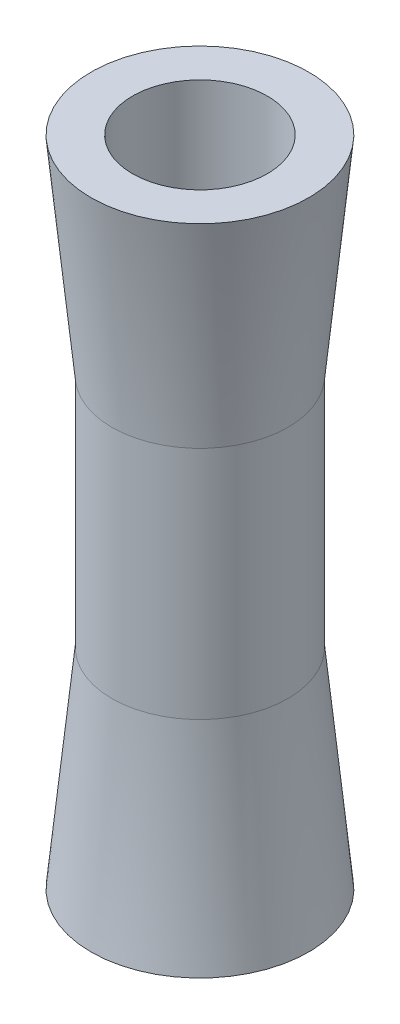
from build123d import *

# Parameters (mm, degrees)
SKETCH1_R           = 8.5
SKETCH1_R_2         = 6.5
BOSS_EXTRUDE1_DEPTH = 63


with BuildPart() as part:
    # Sketch1 → Boss-Extrude1 (new body)
    with BuildSketch(Plane(origin=(0, 0, 0), x_dir=(1, 0, 0), z_dir=(0, 1, 0))):
        with Locations(Location((0, 0, 0), (0, 0, 270))):
            Circle(SKETCH1_R)
        with Locations(Location((0, 0, 0), (0, 0, 270))):
            Circle(SKETCH1_R_2, mode=Mode.SUBTRACT)
    extrude(amount=BOSS_EXTRUDE1_DEPTH)

    # Sketch2 → Revolve1 (revolve)
    with BuildSketch(Plane.XY, mode=Mode.PRIVATE) as revolve1_sk:
        with BuildLine():
            Line((6.5, 63), (6.5, 0))
            Line((6.5, 0), (10.5, 0))
            ThreePointArc((10.5, 0), (8.204635387, 31.5), (10.5, 63))
            Line((10.5, 63), (6.5, 63))
        make_face()
    revolve(revolve1_sk.sketch.rotate(Axis((0, 65.415, 0), (0, -1, 0)), 90), axis=Axis((0, 65.415, 0), (0, -1, 0)))


solid = part.part
